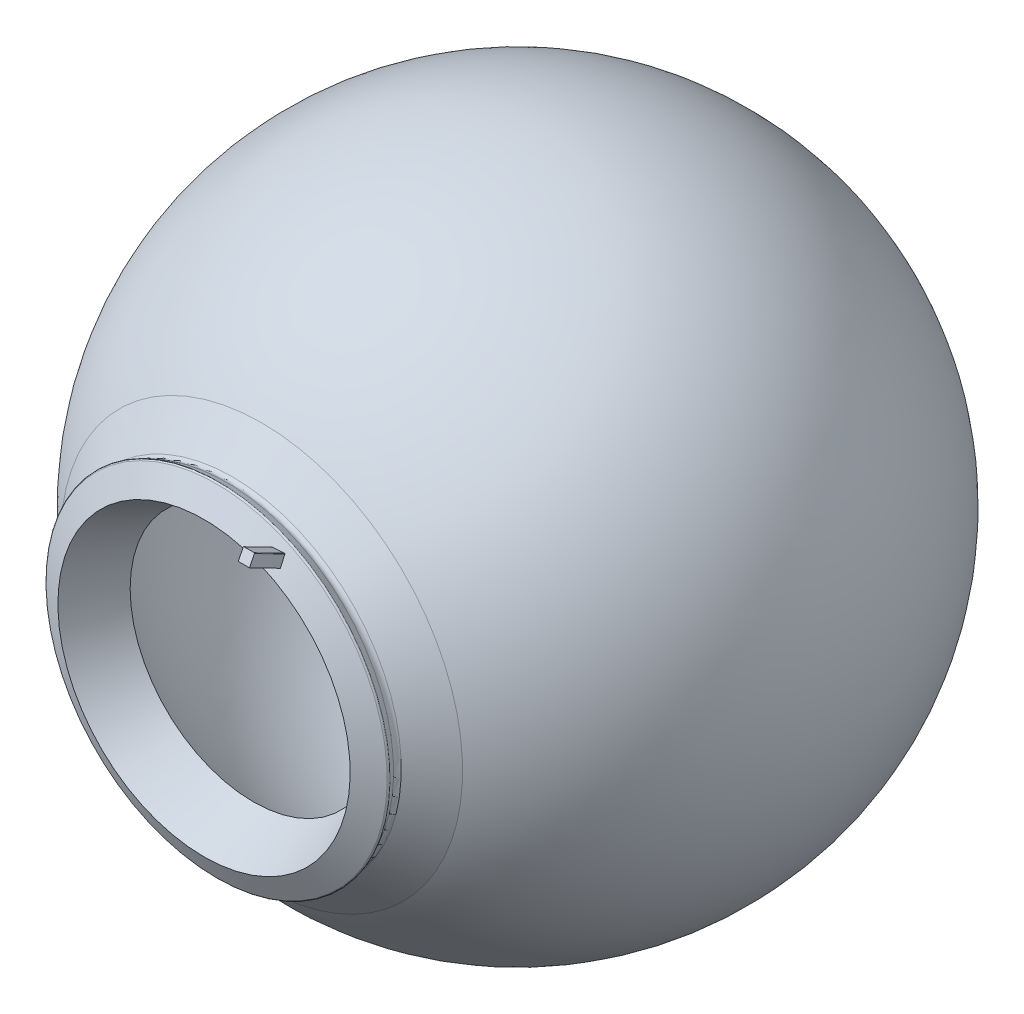
from build123d import *

# Parameters (mm, degrees)
BOSS_EXTRUDE3_DEPTH      = 50
BOSS_EXTRUDE3_DEPTH_BACK = 15


with BuildPart() as part:
    # Sphere Sketch → Sphere (revolve)
    with BuildSketch(Plane(origin=(0, 0, 0), x_dir=(0, 0, -1), z_dir=(1, 0, 0))):
        with BuildLine():
            Line((-587.274308735, 273.648124971), (-552.558139535, 257.471673071))
            Line((-552.558139535, 257.471673071), (-495, 230.651707126))
            ThreePointArc((-495, 230.651707126), (55.906074852, 543.230817236), (531.601551916, 125))
            Line((531.601551916, 125), (593.41568586, 139.534883721))
            Line((593.41568586, 139.534883721), (618.141339438, 145.348837209))
            Line((618.141339438, 145.348837209), (568.384355354, 220.343787272))
            ThreePointArc((568.384355354, 220.343787272), (89.800502747, 602.949442082), (-479.506339183, 376.411783401))
            Line((-479.506339183, 376.411783401), (-533.692189105, 315.721145663))
            ThreePointArc((-533.692189105, 315.721145663), (-539.321048901, 312.550143885), (-545.714010445, 313.482537358))
            Line((-545.714010445, 313.482537358), (-559.670433417, 320.673382776))
            ThreePointArc((-559.670433417, 320.673382776), (-561.95861772, 320.863883523), (-563.711312727, 319.380597256))
            Line((-563.711312727, 319.380597256), (-587.274308735, 273.648124971))
        make_face()
    revolve(axis=Axis((0, 0, 0), (0, 0, -1)))

    # Sketch1 → Boss-Extrude3 (add, two sides: drawn at the far end of the back side and taken through both)
    with BuildSketch(Plane(origin=(0, 296.514361113, 575.492810731), x_dir=(1, 0, 0), z_dir=(0, 0.45801563170636533, 0.8889441383532597)).offset(-BOSS_EXTRUDE3_DEPTH_BACK)):
        with BuildLine():
            Line((114.40522717, -36.492315976), (134.313589091, -36.492315976))
            Line((134.313589091, -36.492315976), (134.313589091, -15.953517695))
            ThreePointArc((134.313589091, -15.953517695), (134.020695872, -15.246410914), (133.313589091, -14.953517695))
            Line((133.313589091, -14.953517695), (114.40522717, -14.953517695))
            ThreePointArc((114.40522717, -14.953517695), (113.698120389, -15.246410914), (113.40522717, -15.953517695))
            Line((113.40522717, -15.953517695), (113.40522717, -35.492315976))
            ThreePointArc((113.40522717, -35.492315976), (113.698120389, -36.199422758), (114.40522717, -36.492315976))
        make_face()
    extrude(amount=BOSS_EXTRUDE3_DEPTH + BOSS_EXTRUDE3_DEPTH_BACK)


solid = part.part
